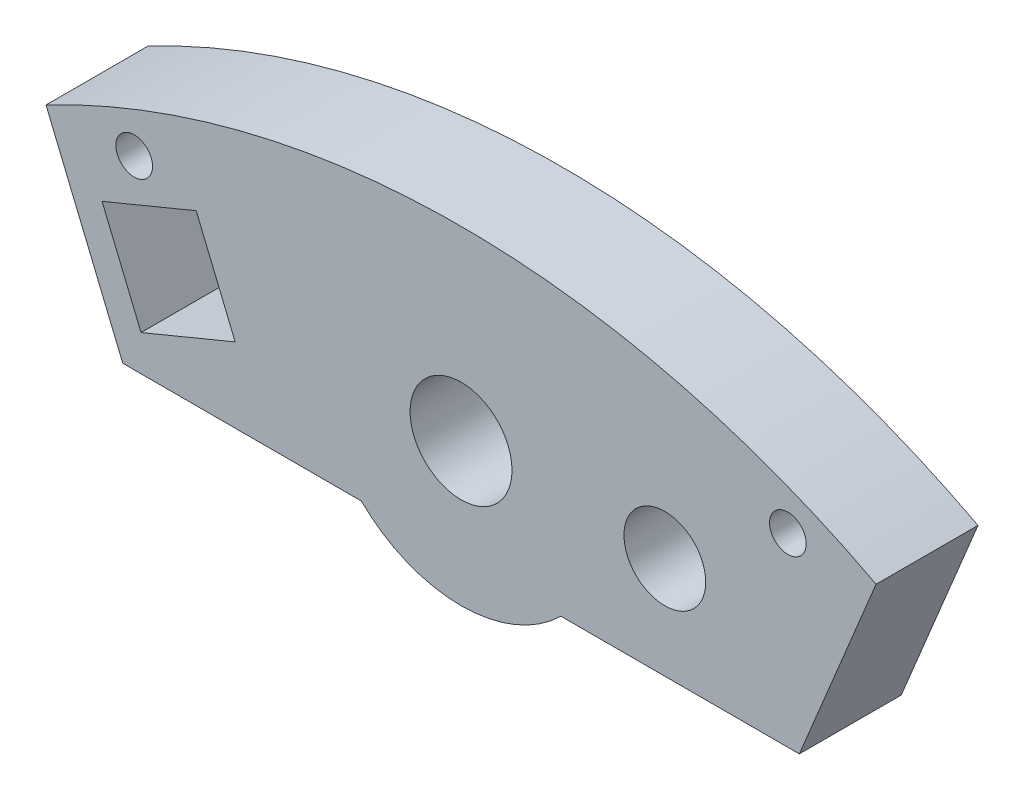
from build123d import *

# Parameters (mm, degrees)
SKETCH1_R           = 4.0125
SKETCH1_R_2         = 5
SKETCH1_R_3         = 1.8
BOSS_EXTRUDE1_DEPTH = 10


with BuildPart() as part:
    # Sketch1 → Boss-Extrude1 (new body)
    with BuildSketch(Plane.XY):
        with BuildLine():
            Line((-40.735590092, 8.189406634), (-33.201291173, -10))
            Line((-33.201291173, -10), (-9.797958971, -10))
            ThreePointArc((-9.797958971, -10), (0, -14), (9.797958971, -10))
            Line((9.797958971, -10), (33.201291173, -10))
            Line((33.201291173, -10), (40.735590092, 8.189406634))
            ThreePointArc((40.735590092, 8.189406634), (0, 18.25), (-40.735590092, 8.189406634))
        make_face()
        with Locations((20, 0)):
            Circle(SKETCH1_R, mode=Mode.SUBTRACT)
        Circle(SKETCH1_R_2, mode=Mode.SUBTRACT)
        with Locations((-32.07645249, 8.189406634)):
            Circle(SKETCH1_R_3, mode=Mode.SUBTRACT)
        with Locations(Location((32.07645249, 8.189406634, 0), (0, 0, 180))):
            Circle(SKETCH1_R_3, mode=Mode.SUBTRACT)
        Polygon((-25.995276927, 6.573779763), (-35.234072252, 2.746945439), (-31.407237928, -6.491849886), (-22.168442603, -2.665015562), align=None, mode=Mode.SUBTRACT)
    extrude(amount=BOSS_EXTRUDE1_DEPTH)


solid = part.part
